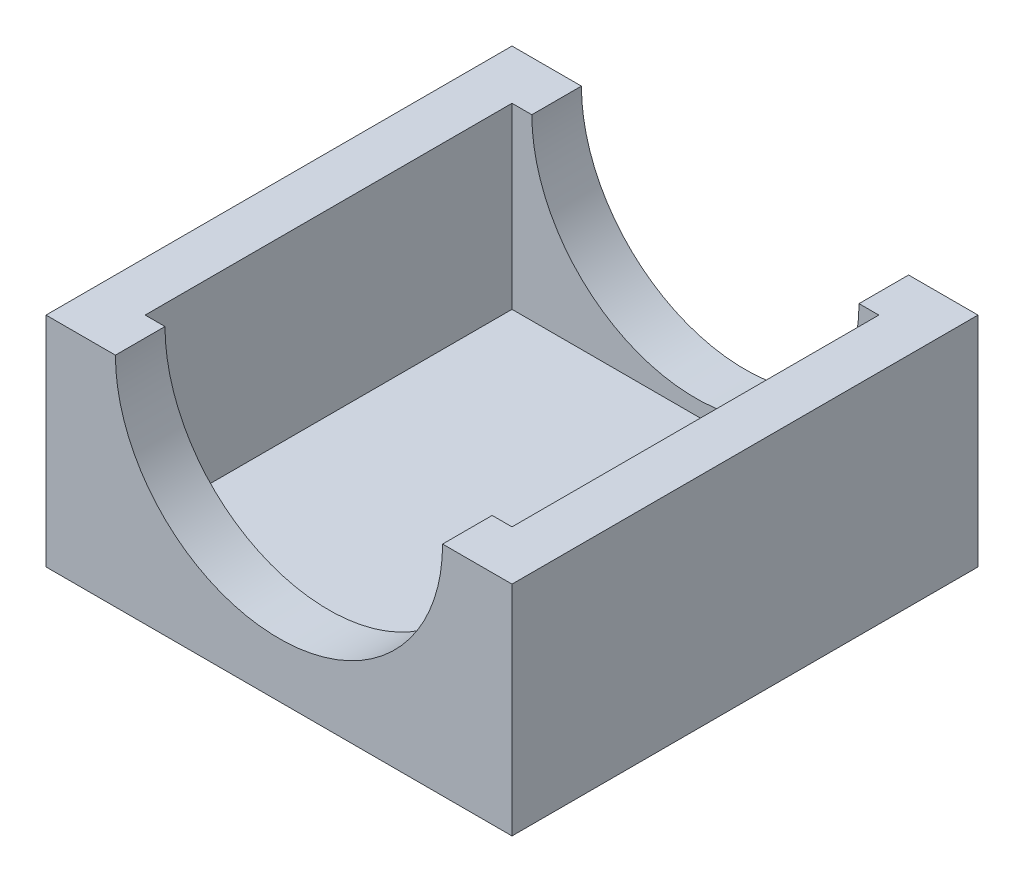
from build123d import *

# Parameters (mm, degrees)
SKETCH1_W           = 74.6125
SKETCH1_H           = 74.6125
BOSS_EXTRUDE1_DEPTH = 34.925
SKETCH2_R           = 26.19375
CUT_EXTRUDE1_DEPTH  = 91.435264528
SKETCH3_W           = 58.7375
SKETCH3_H           = 58.7375
CUT_EXTRUDE2_DEPTH  = 28.575


with BuildPart() as part:
    # Sketch1 → Boss-Extrude1 (new body)
    with BuildSketch(Plane(origin=(0, 0, 0), x_dir=(1, 0, 0), z_dir=(0, 1, 0))):
        Rectangle(SKETCH1_W, SKETCH1_H)
    extrude(amount=BOSS_EXTRUDE1_DEPTH)

    # Sketch2 → Cut-Extrude1 (cut, through all)
    with BuildSketch(Plane.XY.offset(37.30625)):
        with Locations((0, 34.925)):
            Circle(SKETCH2_R)
    extrude(amount=-CUT_EXTRUDE1_DEPTH, mode=Mode.SUBTRACT)

    # Sketch3 → Cut-Extrude2 (cut)
    with BuildSketch(Plane(origin=(0, 34.925, 0), x_dir=(1, 0, 0), z_dir=(0, 1, 0))):
        Rectangle(SKETCH3_W, SKETCH3_H)
    extrude(amount=-CUT_EXTRUDE2_DEPTH, mode=Mode.SUBTRACT)


solid = part.part
